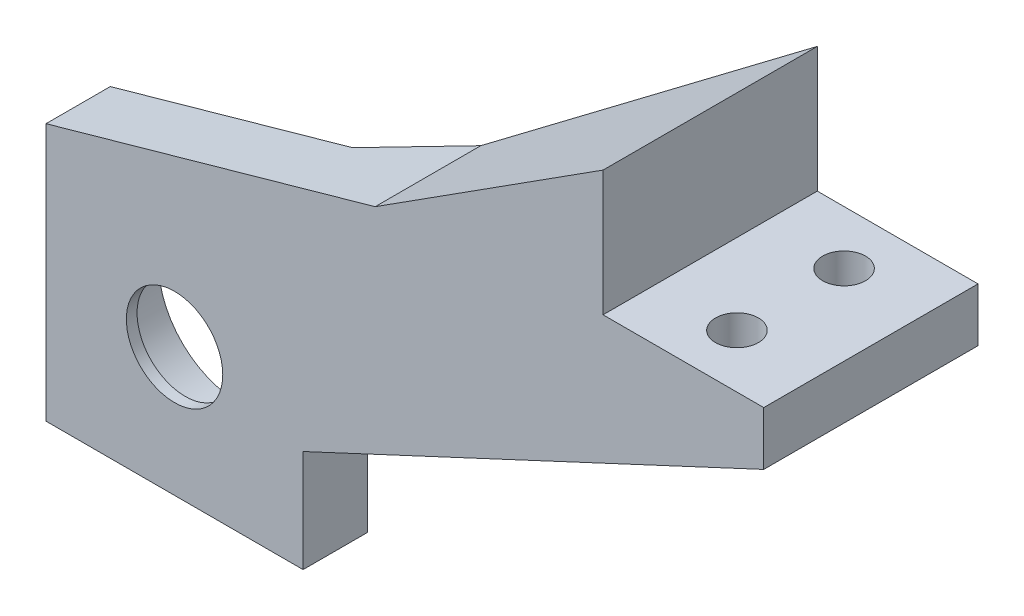
from build123d import *

# Parameters (mm, degrees)
SKETCH1_R           = 10
SKETCH1_R_2         = 7.5
BOSS_EXTRUDE1_DEPTH = 5
BOSS_EXTRUDE2_START = 1
SKETCH1_3_R         = 10
SKETCH1_3_R_2       = 7.5
SKETCH1_3_R_3       = 4.5
BOSS_EXTRUDE2_DEPTH = 1
SKETCH2_R           = 10
BOSS_EXTRUDE3_DEPTH = 6
BOSS_EXTRUDE7_REACH = 67.17
SKETCH3_W           = 15
SKETCH3_H           = 14
SKETCH4_R           = 2
CUT_EXTRUDE4_DEPTH  = 68.699039875
CUT_EXTRUDE5_START  = 3
SKETCH4_3_R         = 2
CUT_EXTRUDE5_DEPTH  = 65.699039875
BOSS_EXTRUDE8_REACH = 69.699
CUT_EXTRUDE6_DEPTH  = 69.867191027


with BuildPart() as part:
    # Sketch1 → Boss-Extrude1 (new body)
    with BuildSketch(Plane.XY):
        Circle(SKETCH1_R)
        Circle(SKETCH1_R_2, mode=Mode.SUBTRACT)
    extrude(amount=-BOSS_EXTRUDE1_DEPTH)

    # Sketch1<3> → Boss-Extrude2 (add)
    # profile 1 of 2: a face of its own
    with BuildSketch(Plane.XY.offset(BOSS_EXTRUDE2_START)):
        Circle(SKETCH1_3_R)
        Circle(SKETCH1_3_R_2, mode=Mode.SUBTRACT)
    # profile 2 of 2: a face of its own
    with BuildSketch(Plane.XY.offset(BOSS_EXTRUDE2_START)):
        Circle(SKETCH1_3_R_2)
        Circle(SKETCH1_3_R_3, mode=Mode.SUBTRACT)
    extrude(amount=-BOSS_EXTRUDE2_DEPTH)

    # Sketch2 → Boss-Extrude3 (add)
    with BuildSketch(Plane.XY.offset(1)):
        Polygon((55, 17.6), (55, 22.6), (40, 22.6), (40, 36.3), (-12, 12.052001776), (-12, -12), (12, -12), (12, -2.451229301), align=None)
        Circle(SKETCH2_R, mode=Mode.SUBTRACT)
    extrude(amount=-BOSS_EXTRUDE3_DEPTH)

    # Boss-Extrude7: up to this plane
    boss_extrude7_end = Plane(origin=(3.082149634, -6.609691221, -87.594733488), z_dir=(-0.42261826174069755, 0.9063077870366509, 0))
    # Sketch3 → Boss-Extrude7 (add, up to the surface)
    with BuildSketch(Plane.XZ.offset(-22.6), mode=Mode.PRIVATE) as boss_extrude7_sk1:
        Polygon((40, -5), (40, -19), (10.620255189, -5), align=None)
    boss_extrude7_tool1 = split(extrude(boss_extrude7_sk1.sketch, amount=BOSS_EXTRUDE7_REACH, mode=Mode.PRIVATE), bisect_by=boss_extrude7_end, keep=Keep.BOTH, mode=Mode.PRIVATE)
    add(boss_extrude7_tool1.solids().sort_by_distance((30.206752, 22.6, -9.666667))[0])
    # Sketch3 → Boss-Extrude7 (add, up to the surface)
    with BuildSketch(Plane.XZ.offset(-22.6), mode=Mode.PRIVATE) as boss_extrude7_sk2:
        with Locations((47.5, -12)):
            Rectangle(SKETCH3_W, SKETCH3_H)
    boss_extrude7_tool2 = split(extrude(boss_extrude7_sk2.sketch, amount=BOSS_EXTRUDE7_REACH, mode=Mode.PRIVATE), bisect_by=boss_extrude7_end, keep=Keep.BOTH, mode=Mode.PRIVATE)
    add(boss_extrude7_tool2.solids().sort_by_distance((47.5, 22.6, -12))[0])

    # Sketch4 → Cut-Extrude4 (cut, through all)
    with BuildSketch(Plane.XZ.offset(-22.6)):
        with Locations((47.5, -14)):
            Circle(SKETCH4_R)
        with Locations((47.5, -4)):
            Circle(SKETCH4_R)
    extrude(amount=CUT_EXTRUDE4_DEPTH, mode=Mode.SUBTRACT)

    # Sketch4<3> → Cut-Extrude5 (cut, through all)
    # profile 1 of 2: a face of its own
    with BuildSketch(Plane.XZ.offset(-22.6).offset(CUT_EXTRUDE5_START)):
        Polygon((47.5, -8.041451884), (44, -6.020725942), (44, -1.979274058), (47.5, 0.041451884), (51, -1.979274058), (51, -6.020725942), align=None)
        with Locations(Location((47.5, -4, 0), (0, 0, 90))):
            Circle(SKETCH4_3_R, mode=Mode.SUBTRACT)
    # profile 2 of 2: a face of its own
    with BuildSketch(Plane.XZ.offset(-22.6).offset(CUT_EXTRUDE5_START)):
        Polygon((51, -16.020725942), (51, -11.979274058), (47.5, -9.958548116), (44, -11.979274058), (44, -16.020725942), (47.5, -18.041451884), align=None)
        with Locations(Location((47.5, -14, 0), (0, 0, 90))):
            Circle(SKETCH4_3_R, mode=Mode.SUBTRACT)
    extrude(amount=CUT_EXTRUDE5_DEPTH, mode=Mode.SUBTRACT)

    # Boss-Extrude8: up to this face of the body (flat: up to its plane)
    boss_extrude8_end = Plane(part.part.faces().sort_by_distance((14, 24.176000888, -2))[0])
    # Sketch3<4> → Boss-Extrude8 (add, up to the picked face)
    with BuildSketch(Plane.XZ.offset(-22.6), mode=Mode.PRIVATE) as boss_extrude8_sk1:
        Polygon((40, -5), (40, -19), (10.620255189, -5), align=None)
    boss_extrude8_tool1 = split(extrude(boss_extrude8_sk1.sketch, amount=-BOSS_EXTRUDE8_REACH, mode=Mode.PRIVATE), bisect_by=boss_extrude8_end, keep=Keep.BOTH, mode=Mode.PRIVATE)
    add(boss_extrude8_tool1.solids().sort_by(Axis((30.206752, 22.6, -9.666667), (0, 1, 0)))[0])

    # Sketch6 → Cut-Extrude6 (cut, through all)
    with BuildSketch(Plane.XY.offset(1)):
        Polygon((-12, 12.052001776), (18.725283831, 20.703901024), (15.930931538, 25.076409051), align=None)
        Polygon((15.930931538, 25.076409051), (18.725283831, 20.703901024), (40, 34.3), (40, 36.3), align=None)
    extrude(amount=-CUT_EXTRUDE6_DEPTH, mode=Mode.SUBTRACT)


solid = part.part
